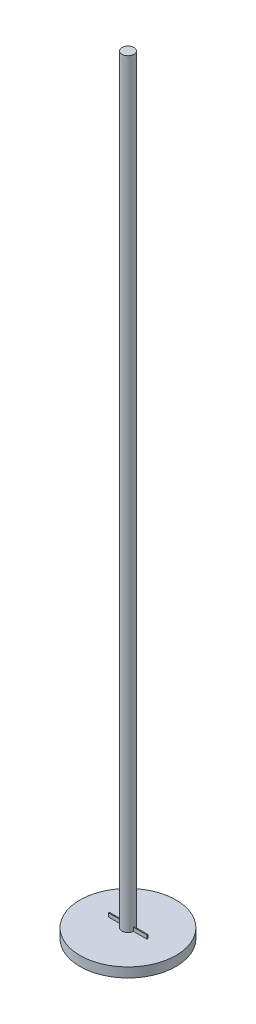
from build123d import *

# Parameters (mm, degrees)
SKETCH_1_R      = 5
EXTRUDE_1_DEPTH = 1
SKETCH_2_R      = 0.622519756
EXTRUDE_2_DEPTH = 80
SKETCH_3_W      = 4.001607156
SKETCH_3_H      = 1.375795034
EXTRUDE_3_DEPTH = 0.05


with BuildPart() as part:
    # 草图1 → 凸台-拉伸1 (new body)
    with BuildSketch(Plane(origin=(0, 0, 0), x_dir=(1, 0, 0), z_dir=(0, 1, 0))):
        with Locations(Location((0, 0, 0), (0, 0, 270))):
            Circle(SKETCH_1_R)
    extrude(amount=EXTRUDE_1_DEPTH)

    # 草图2 → 凸台-拉伸2 (add)
    with BuildSketch(Plane(origin=(0, 0, 0), x_dir=(1, 0, 0), z_dir=(0, 1, 0))):
        with Locations(Location((0, 0, 0), (0, 0, 270))):
            Circle(SKETCH_2_R)
    extrude(amount=EXTRUDE_2_DEPTH)

    # 草图3 → 凸台-拉伸3 (add, symmetric)
    with BuildSketch(Plane.XY):
        with Locations((0.019961676, 0.687897517)):
            Rectangle(SKETCH_3_W, SKETCH_3_H)
    extrude(amount=EXTRUDE_3_DEPTH, both=True)


solid = part.part
